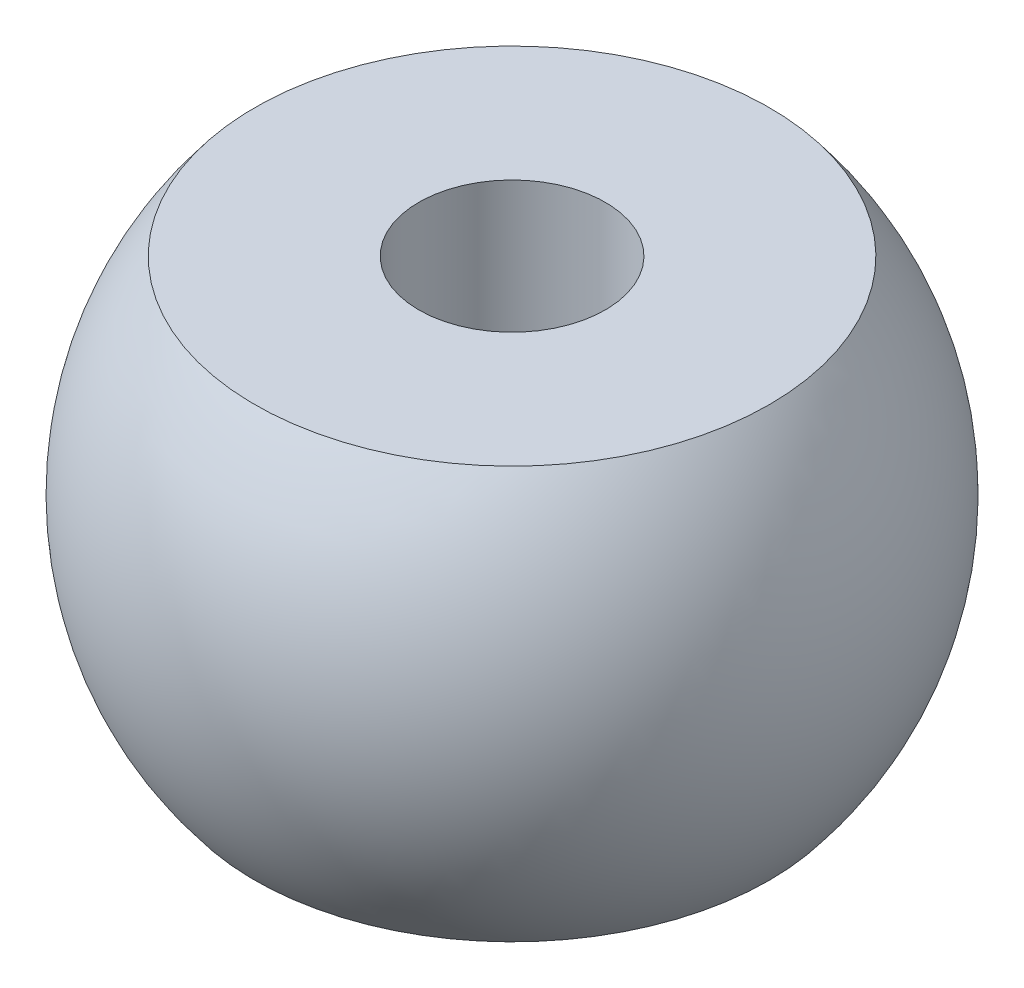
from build123d import *


with BuildPart() as part:
    # Sketch1 → Revolve2 (revolve)
    with BuildSketch(Plane.XY):
        with BuildLine():
            Line((3, 6.625), (8.274622348, 6.625))
            ThreePointArc((8.274622348, 6.625), (10.6, 0), (8.274622348, -6.625))
            Line((8.274622348, -6.625), (3, -6.625))
            Line((3, -6.625), (3, 6.625))
        make_face()
    revolve(axis=Axis((0, 6.625, 0), (0, -1, 0)))


solid = part.part
